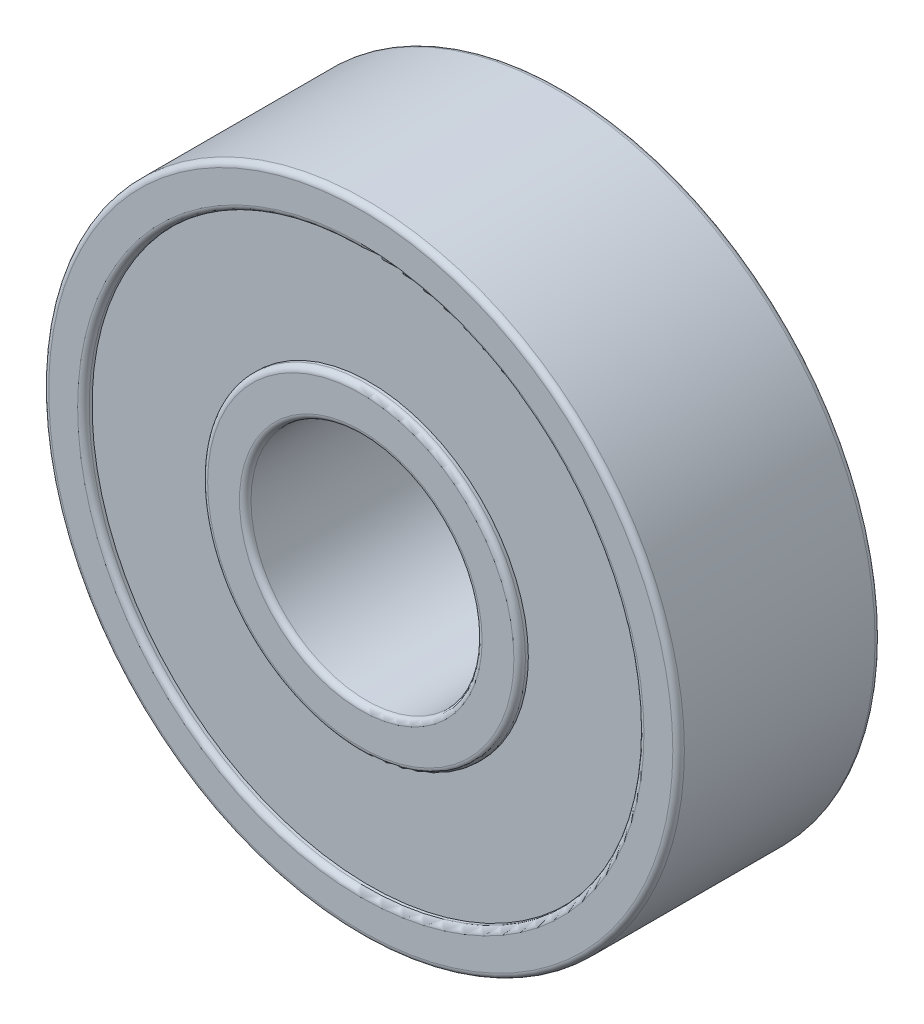
from build123d import *

# Parameters (mm, degrees)
SKETCH1_R           = 11
SKETCH1_R_2         = 4
BOSS_EXTRUDE1_DEPTH = 3.5
SKETCH2_W           = 0.3
SKETCH2_H           = 4.1
FILLET1_R           = 0.2


with BuildPart() as part:
    # Sketch1 → Boss-Extrude1 (new, symmetric)
    with BuildSketch(Plane.XY):
        Circle(SKETCH1_R)
        Circle(SKETCH1_R_2, mode=Mode.SUBTRACT)
    extrude(amount=BOSS_EXTRUDE1_DEPTH, both=True)

    # Sketch2 → Cut-Revolve1 (revolve, cut)
    with BuildSketch(Plane(origin=(0, 0, 0), x_dir=(0, 0, -1), z_dir=(1, 0, 0)), mode=Mode.PRIVATE) as cut_revolve1_sk:
        with Locations((3.35, 7.55)):
            Rectangle(SKETCH2_W, SKETCH2_H)
    cut_revolve1 = revolve(cut_revolve1_sk.sketch.rotate(Axis((0, 0, 8.181614894), (0, 0, -1)), 90), axis=Axis((0, 0, 8.181614894), (0, 0, -1)), mode=Mode.SUBTRACT)

    # Mirror1: Cut-Revolve1 across plane
    add(cut_revolve1.mirror(Plane.XY), mode=Mode.SUBTRACT)

    # Fillet1
    fillet1_edges = [part.edges().sort_by_distance(p)[0] for p in [
        (-9.6, 0, -3.5),
        (-5.5, 0, -3.5),
        (-9.6, 0, 3.5),
        (-5.5, 0, 3.5),
        (-11, 0, -3.5),
        (-11, 0, 3.5),
        (-4, 0, -3.5),
        (-4, 0, 3.5),
    ]]
    fillet(fillet1_edges, radius=FILLET1_R)


solid = part.part
